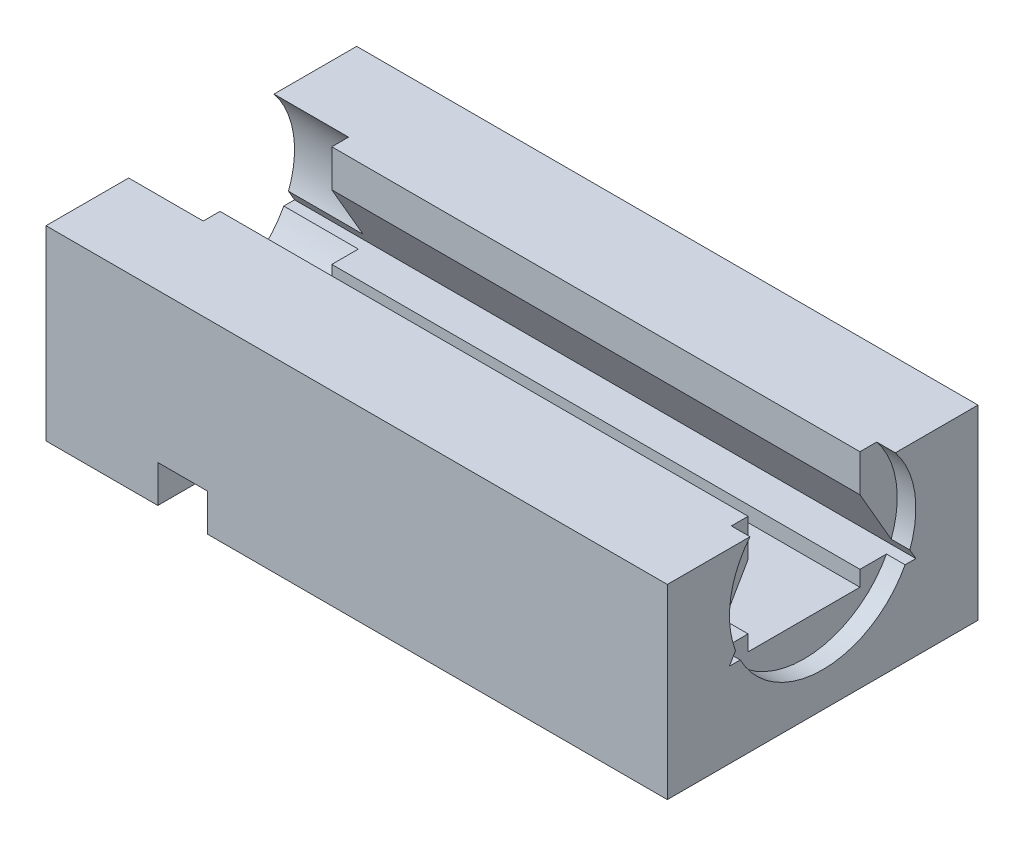
from build123d import *

# Parameters (mm, degrees)
SKETCH1_W           = 10
SKETCH1_H           = 5
BOSS_EXTRUDE1_DEPTH = 3
CUT_EXTRUDE9_DEPTH  = 12.874342087
SKETCH20_R          = 1.5
CUT_EXTRUDE11_DEPTH = 1.2
CUT_EXTRUDE12_START = -0.3
SKETCH22_R          = 1.5
SKETCH22_R_2        = 0.55
CUT_EXTRUDE12_DEPTH = 0.3
SKETCH24_W          = 0.8
SKETCH24_H          = 0.6
CUT_EXTRUDE13_DEPTH = 12.874342087


with BuildPart() as part:
    # Sketch1 → Boss-Extrude1 (new body)
    with BuildSketch(Plane(origin=(0, 4, 0), x_dir=(-1, 0, 0), z_dir=(0, 1, 0))):
        with Locations((-5, 2.5)):
            Rectangle(SKETCH1_W, SKETCH1_H)
    extrude(amount=-BOSS_EXTRUDE1_DEPTH)

    # Sketch18 → Cut-Extrude9 (cut, through all)
    with BuildSketch(Plane(origin=(10, 0, 0), x_dir=(0, 0, -1), z_dir=(1, 0, 0))):
        Polygon((-3.4, 3.4), (-4, 2.360769515), (-3.4, 2.360769515), (-3.4, 2.110769515), (-1.6, 2.110769515), (-1.6, 2.360769515), (-1, 2.360769515), (-1.6, 3.4), (-1.6, 4), (-3.4, 4), align=None)
    extrude(amount=-CUT_EXTRUDE9_DEPTH, mode=Mode.SUBTRACT)

    # Sketch20 → Cut-Extrude11 (cut)
    with BuildSketch(Plane.ZY):
        with Locations((2.5, 3.060769515)):
            Circle(SKETCH20_R)
    extrude(amount=-CUT_EXTRUDE11_DEPTH, mode=Mode.SUBTRACT)

    # Sketch22 → Cut-Extrude12 (cut)
    with BuildSketch(Plane(origin=(10, 0, 0), x_dir=(0, 0, -1), z_dir=(1, 0, 0)).offset(CUT_EXTRUDE12_START)):
        with Locations((-2.5, 3.060769515)):
            Circle(SKETCH22_R)
        with Locations((-2.5, 3.060769515)):
            Circle(SKETCH22_R_2, mode=Mode.SUBTRACT)
    extrude(amount=CUT_EXTRUDE12_DEPTH, mode=Mode.SUBTRACT)

    # Sketch24 → Cut-Extrude13 (cut, through all)
    with BuildSketch(Plane.XY.offset(5)):
        with Locations((2.2, 1.3)):
            Rectangle(SKETCH24_W, SKETCH24_H)
    extrude(amount=-CUT_EXTRUDE13_DEPTH, mode=Mode.SUBTRACT)


solid = part.part
